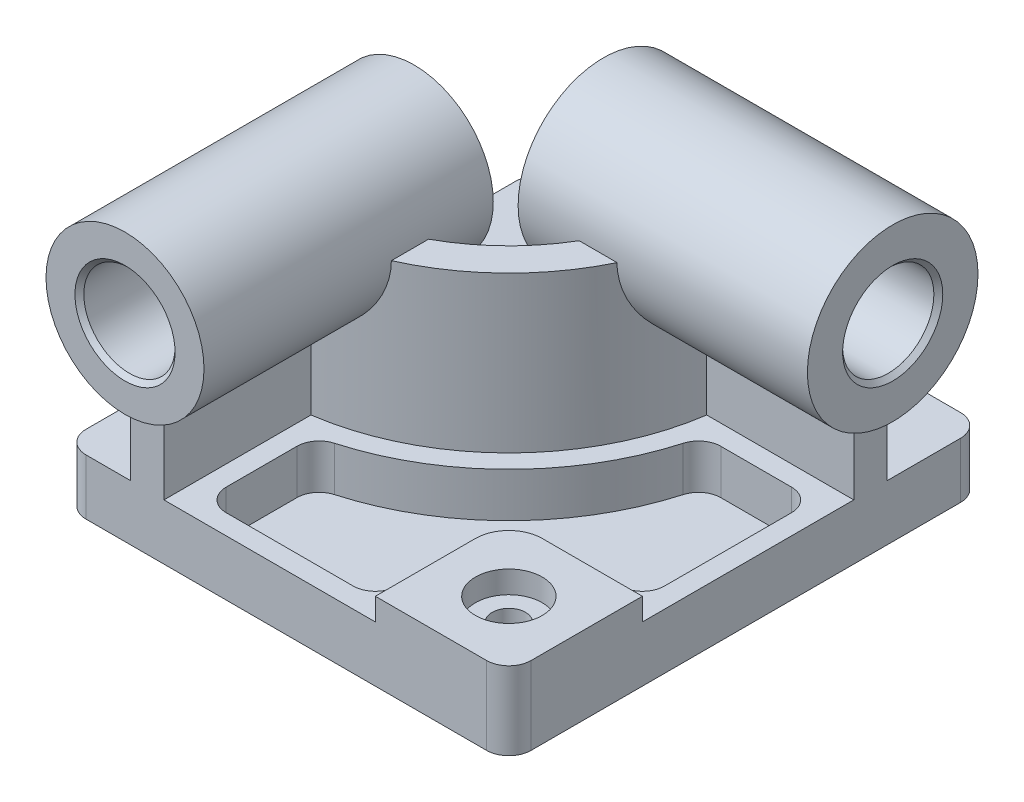
from build123d import *

# Parameters (mm, degrees)
BOSS_EXTRUDE1_DEPTH                     = 25
BOSS_EXTRUDE2_START                     = -25
BOSS_EXTRUDE2_DEPTH                     = 95
BOSS_EXTRUDE3_DEPTH                     = 10
CBORE_FOR_M8_HEX_HEAD_BOLT1_D           = 15
CBORE_FOR_M8_HEX_HEAD_BOLT1_CBORE_D     = 30
CBORE_FOR_M8_HEX_HEAD_BOLT1_CBORE_DEPTH = 10
CUT_EXTRUDE1_DEPTH                      = 20
BOSS_EXTRUDE4_START                     = 10
SKETCH7_R                               = 35.5
BOSS_EXTRUDE4_DEPTH                     = 130
BOSS_EXTRUDE5_START                     = 10
SKETCH8_R                               = 38.333333333
BOSS_EXTRUDE5_DEPTH                     = 130
CUT_EXTRUDE2_REACH                      = 318.08
SKETCH9_R                               = 20.5
CUT_EXTRUDE3_REACH                      = 309.047
SKETCH10_R                              = 20.5
CHAMFER1_SIZE                           = 2


with BuildPart() as part:
    # Sketch1 → Boss-Extrude1 (new body)
    with BuildSketch(Plane(origin=(0, 0, 0), x_dir=(1, 0, 0), z_dir=(0, 1, 0))):
        with BuildLine():
            Line((-20, 43), (160, 43))
            ThreePointArc((160, 43), (167.071067812, 40.071067812), (170, 33))
            Line((170, 33), (170, -160))
            ThreePointArc((170, -160), (167.071067812, -167.071067812), (160, -170))
            Line((160, -170), (-20, -170))
            ThreePointArc((-20, -170), (-27.071067812, -167.071067812), (-30, -160))
            Line((-30, -160), (-30, 33))
            ThreePointArc((-30, 33), (-27.071067812, 40.071067812), (-20, 43))
        make_face()
    extrude(amount=BOSS_EXTRUDE1_DEPTH)

    # Sketch2 → Boss-Extrude2 (add)
    with BuildSketch(Plane(origin=(0, 25, 0), x_dir=(1, 0, 0), z_dir=(0, 1, 0)).offset(BOSS_EXTRUDE2_START)):
        with BuildLine():
            Line((0, -90), (0, -170))
            Line((0, -170), (15, -170))
            Line((15, -170), (15, -103.923048454))
            ThreePointArc((15, -103.923048454), (74.246212025, -74.246212025), (103.923048454, -15))
            Line((103.923048454, -15), (170, -15))
            Line((170, -15), (170, 0))
            Line((170, 0), (90, 0))
            ThreePointArc((90, 0), (63.639610307, -63.639610307), (0, -90))
        make_face()
    extrude(amount=BOSS_EXTRUDE2_DEPTH)

    # Sketch3 → Boss-Extrude3 (add)
    with BuildSketch(Plane(origin=(0, 25, 0), x_dir=(1, 0, 0), z_dir=(0, 1, 0))):
        with BuildLine():
            Line((125, -110), (170, -110))
            Line((170, -110), (170, -160))
            ThreePointArc((170, -160), (167.071067812, -167.071067812), (160, -170))
            Line((160, -170), (110, -170))
            Line((110, -170), (110, -125))
            ThreePointArc((110, -125), (114.393398282, -114.393398282), (125, -110))
        make_face()
    extrude(amount=BOSS_EXTRUDE3_DEPTH)

    # CBORE for M8 Hex Head Bolt1 (through all)
    with Locations(Plane(origin=(0, 35, 0), x_dir=(1, 0, 0), z_dir=(0, 1, 0))):
        with Locations((140, -140)):
            CounterBoreHole(CBORE_FOR_M8_HEX_HEAD_BOLT1_D / 2, CBORE_FOR_M8_HEX_HEAD_BOLT1_CBORE_D / 2, CBORE_FOR_M8_HEX_HEAD_BOLT1_CBORE_DEPTH)

    # Sketch6 → Cut-Extrude1 (cut)
    with BuildSketch(Plane(origin=(0, 25, 0), x_dir=(1, 0, 0), z_dir=(0, 1, 0))):
        with BuildLine():
            Line((101, -151), (101, -125))
            ThreePointArc((101, -125), (108.029437252, -108.029437252), (125, -101))
            Line((125, -101), (151, -101))
            ThreePointArc((151, -101), (158.071067812, -98.071067812), (161, -91))
            Line((161, -91), (161, -34))
            ThreePointArc((161, -34), (158.071067812, -26.928932188), (151, -24))
            Line((151, -24), (119.247641486, -24))
            ThreePointArc((119.247641486, -24), (113.223496519, -26.018165786), (109.630896205, -31.258064516))
            ThreePointArc((109.630896205, -31.258064516), (80.610173055, -80.610173055), (31.258064516, -109.630896205))
            ThreePointArc((31.258064516, -109.630896205), (26.018165786, -113.223496519), (24, -119.247641486))
            Line((24, -119.247641486), (24, -151))
            ThreePointArc((24, -151), (26.928932188, -158.071067812), (34, -161))
            Line((34, -161), (91, -161))
            ThreePointArc((91, -161), (98.071067812, -158.071067812), (101, -151))
        make_face()
    extrude(amount=-CUT_EXTRUDE1_DEPTH, mode=Mode.SUBTRACT)

    # Sketch7 → Boss-Extrude4 (add)
    with BuildSketch(Plane.XY.offset(170).offset(BOSS_EXTRUDE4_START)):
        with Locations((7.5, 95)):
            Circle(SKETCH7_R)
    extrude(amount=-BOSS_EXTRUDE4_DEPTH)

    # Sketch8 → Boss-Extrude5 (add)
    with BuildSketch(Plane(origin=(170, 0, 0), x_dir=(0, 0, -1), z_dir=(1, 0, 0)).offset(BOSS_EXTRUDE5_START)):
        with Locations((-7.5, 95)):
            Circle(SKETCH8_R)
    extrude(amount=-BOSS_EXTRUDE5_DEPTH)

    # Sketch9 → Cut-Extrude2 (cut, up to next)
    with BuildSketch(Plane.XY.offset(180), mode=Mode.PRIVATE) as cut_extrude2_sk1:
        with Locations((7.5, 95)):
            Circle(SKETCH9_R)
    cut_extrude2_tool1 = extrude(cut_extrude2_sk1.sketch, amount=-CUT_EXTRUDE2_REACH, mode=Mode.PRIVATE) & part.part
    add(cut_extrude2_tool1.solids().sort_by_distance((7.5, 95, 180))[0], mode=Mode.SUBTRACT)

    # Sketch10 → Cut-Extrude3 (cut, up to next)
    with BuildSketch(Plane(origin=(180, 0, 0), x_dir=(0, 0, -1), z_dir=(1, 0, 0)), mode=Mode.PRIVATE) as cut_extrude3_sk1:
        with Locations((-7.5, 95)):
            Circle(SKETCH10_R)
    cut_extrude3_tool1 = extrude(cut_extrude3_sk1.sketch, amount=-CUT_EXTRUDE3_REACH, mode=Mode.PRIVATE) & part.part
    add(cut_extrude3_tool1.solids().sort_by_distance((180, 95, 7.5))[0], mode=Mode.SUBTRACT)

    # Chamfer1
    chamfer1_edges = [part.edges().sort_by_distance(p)[0] for p in [
        (-13, 95, 180),
        (-13, 95, 50),
        (180, 95, 28),
        (50, 95, 28),
    ]]
    chamfer(chamfer1_edges, length=CHAMFER1_SIZE)


solid = part.part
